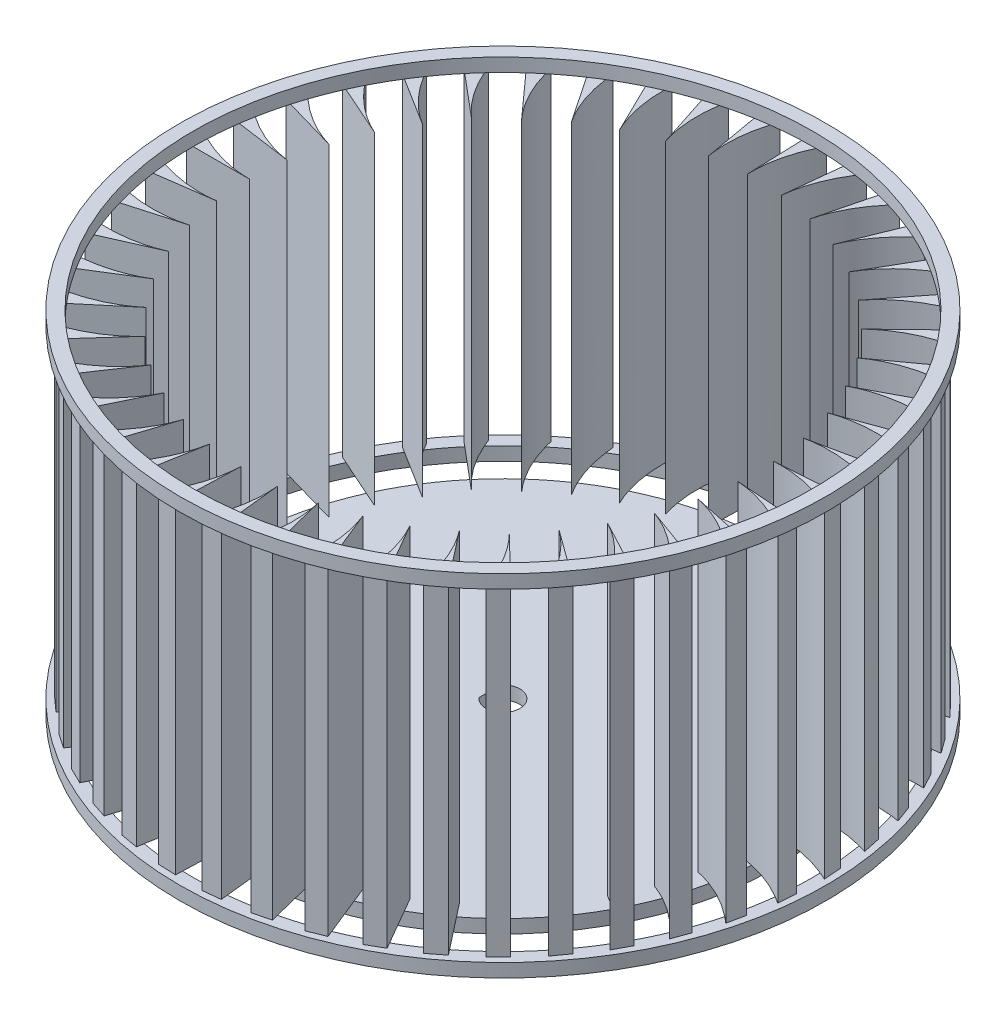
from build123d import *

# Parameters (mm, degrees)
SKETCH1_R           = 76.2
SKETCH1_R_2         = 73.025
BOSS_EXTRUDE1_DEPTH = 3.175
SKETCH3_R           = 63.5
BOSS_EXTRUDE2_DEPTH = 3.175
CUT_EXTRUDE1_DEPTH  = 3.175
BOSS_EXTRUDE3_DEPTH = 76.2
CIRPATTERN2_COUNT   = 45
SKETCH6_R           = 76.2
SKETCH6_R_2         = 73.025
BOSS_EXTRUDE4_DEPTH = 3.175


with BuildPart() as part:
    # Sketch1 → Boss-Extrude1 (new body)
    with BuildSketch(Plane(origin=(0, 0, 0), x_dir=(1, 0, 0), z_dir=(0, 1, 0))):
        with Locations(Location((0, 0, 0), (0, 0, 270))):
            Circle(SKETCH1_R)
        with Locations(Location((0, 0, 0), (0, 0, 270))):
            Circle(SKETCH1_R_2, mode=Mode.SUBTRACT)
    extrude(amount=BOSS_EXTRUDE1_DEPTH)



with BuildPart() as body_2:
    # Sketch3 → Boss-Extrude2 (new body)
    with BuildSketch(Plane(origin=(0, 0, 0), x_dir=(1, 0, 0), z_dir=(0, 1, 0))):
        with Locations(Location((0, 0, 0), (0, 0, 270))):
            Circle(SKETCH3_R)
    extrude(amount=BOSS_EXTRUDE2_DEPTH)

    # Sketch4 → Cut-Extrude1 (cut)
    with BuildSketch(Plane(origin=(0, 3.175, 0), x_dir=(1, 0, 0), z_dir=(0, 1, 0))):
        with BuildLine():
            Line((-3.048, -2.591080132), (-3.048, 2.591080132))
            ThreePointArc((-3.048, 2.591080132), (4.0005, 0), (-3.048, -2.591080132))
        make_face()
    extrude(amount=-CUT_EXTRUDE1_DEPTH, mode=Mode.SUBTRACT)


with BuildPart() as part_1:
    add(part.part)

    add(body_2.part)  # Boss-Extrude3 merges body 2
    # Sketch5 → Boss-Extrude3 (add)
    with BuildSketch(Plane(origin=(0, 3.175, 0), x_dir=(1, 0, 0), z_dir=(0, 1, 0))):
        with BuildLine():
            Line((-74.6125, 4.150951411), (-74.6125, 0))
            Line((-74.6125, 0), (-59.747532966, 0))
            add(Edge.make_bspline(
                [(-74.6125, 4.150951411), (-67.286104924, 0.040392674), (-59.747532966, 0)],
                knots=[0, 0, 0, 0.609678921, 0.609678921, 0.609678921], degree=2))
        make_face()
    boss_extrude3 = extrude(amount=BOSS_EXTRUDE3_DEPTH)

    # CirPattern2: Boss-Extrude3 ×45 about axis
    cirpattern2_axis = Axis((0, 3.175, 0), (0, 1, 0))
    for i in range(1, CIRPATTERN2_COUNT):
        add(boss_extrude3.rotate(cirpattern2_axis, i * 360 / CIRPATTERN2_COUNT))

    # Sketch6 → Boss-Extrude4 (add)
    with BuildSketch(Plane(origin=(0, 79.375, 0), x_dir=(1, 0, 0), z_dir=(0, 1, 0))):
        with Locations(Location((0, 0, 0), (0, 0, 270))):
            Circle(SKETCH6_R)
        with Locations(Location((0, 0, 0), (0, 0, 89.431327104))):
            Circle(SKETCH6_R_2, mode=Mode.SUBTRACT)
    extrude(amount=BOSS_EXTRUDE4_DEPTH)


solid = part_1.part
